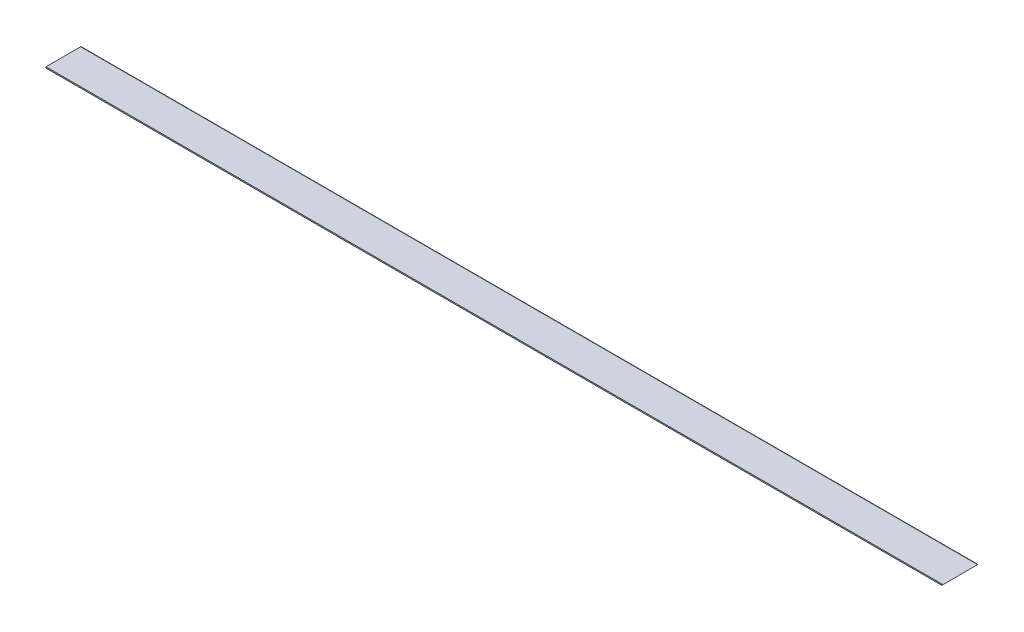
from build123d import *

# Parameters (mm, degrees)
BOSS_EXTRUDE1_DEPTH = 2210
FILLET1_R           = 3
CUT_EXTRUDE1_DEPTH  = 88


with BuildPart() as part:
    # Sketch1 → Boss-Extrude1 (new body)
    with BuildSketch(Plane(origin=(0, 0, 0), x_dir=(0, 0, -1), z_dir=(1, 0, 0))):
        Polygon((0, 0), (88, 0), (88, -88), (85, -88), (85, -3), (0, -3), align=None)
    extrude(amount=BOSS_EXTRUDE1_DEPTH)

    # Fillet1
    fillet1_edges = [part.edges().sort_by_distance(p)[0] for p in [
        (1105, 0, -88),
        (1105, -3, -85),
    ]]
    fillet(fillet1_edges, radius=FILLET1_R)

    # Sketch2 → Cut-Extrude1 (cut)
    with BuildSketch(Plane(origin=(0, 0, -88), x_dir=(-1, 0, 0), z_dir=(0, 0, -1))):
        Polygon((-2210, 0), (-2122, -88), (-2210, -88), align=None)
    extrude(amount=-CUT_EXTRUDE1_DEPTH, mode=Mode.SUBTRACT)


solid = part.part
